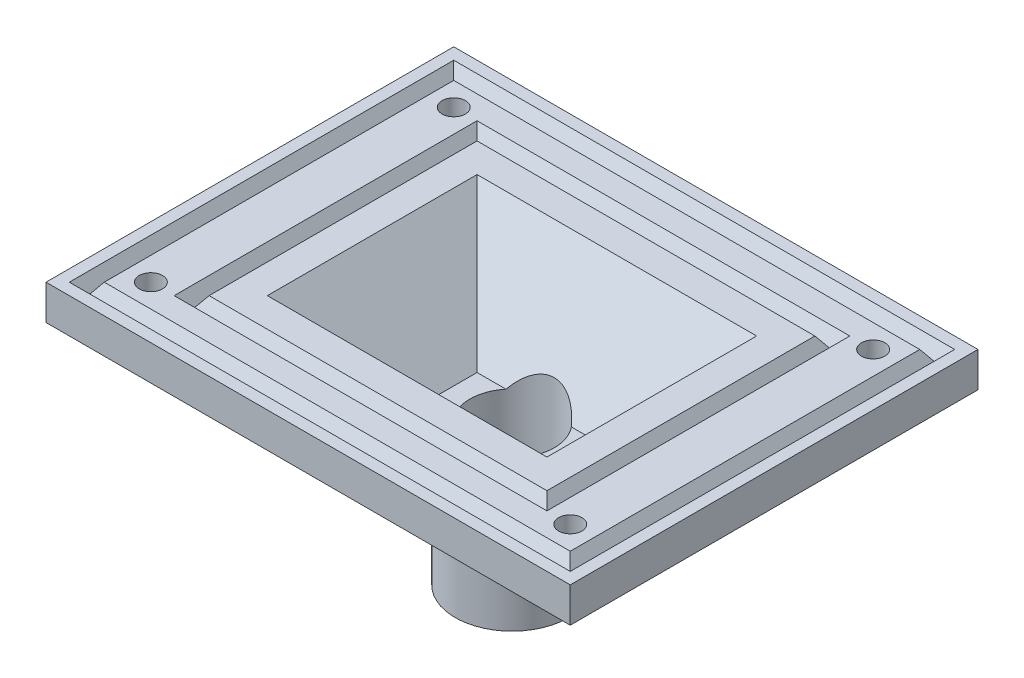
from build123d import *

# Parameters (mm, degrees)
SKETCH1_W               = 90
SKETCH1_H               = 70
BASE_PLATE_DEPTH        = 6
SKETCH4_W               = 86
SKETCH4_H               = 66
SKETCH4_W_2             = 80
SKETCH4_H_2             = 60
SEALANT_CUT_OUTER_DEPTH = 5
SEALANT_CUT_OUTER_TAPER = 35
SKETCH7_R               = 2
SCRE_CUT_DEPTH          = 5
SKETCH12_W              = 64
SKETCH12_H              = 52
SKETCH12_W_2            = 58
SKETCH12_H_2            = 46
SEALANT_CUT_INNER_DEPTH = 3
SEALANT_CUT_INNER_TAPER = 35
SKETCH14_W              = 65
SKETCH14_H              = 45
BASE_BLOCK_DEPTH        = 14
SKETCH13_W              = 48
SKETCH13_H              = 36
DRAIN_DEPTH             = 16
DRAIN_DRAFT             = -40
SKETCH15_R              = 9.75
HOSE_CONNECTOR_DEPTH    = 20
SKETCH16_R              = 7.25
DRAIN_HOLE_DEPTH        = 70.641941443
FILLET1_R               = 10
FILLET2_R               = 10
FILLET3_R               = 10
FILLET4_R               = 10
FILLET5_R               = 10


with BuildPart() as part:
    # Sketch1 → Base Plate (new body)
    with BuildSketch(Plane(origin=(0, 0, 0), x_dir=(1, 0, 0), z_dir=(0, 1, 0))):
        Rectangle(SKETCH1_W, SKETCH1_H)
    extrude(amount=BASE_PLATE_DEPTH)

    # Sketch4 → Sealant Cut - Outer (cut)
    with BuildSketch(Plane(origin=(0, 6, 0), x_dir=(1, 0, 0), z_dir=(0, 1, 0))):
        Rectangle(SKETCH4_W, SKETCH4_H)
        Rectangle(SKETCH4_W_2, SKETCH4_H_2, mode=Mode.SUBTRACT)
    extrude(amount=-SEALANT_CUT_OUTER_DEPTH, taper=SEALANT_CUT_OUTER_TAPER, mode=Mode.SUBTRACT)

    # Sketch7 → Scre Cut (cut)
    with BuildSketch(Plane(origin=(0, 6, 0), x_dir=(1, 0, 0), z_dir=(0, 1, 0))):
        with Locations(Location((-36, 26, 0), (0, 0, 270))):
            Circle(SKETCH7_R)
        with Locations(Location((-36, -26, 0), (0, 0, 90))):
            Circle(SKETCH7_R)
        with Locations(Location((36, -26, 0), (0, 0, 270))):
            Circle(SKETCH7_R)
        with Locations(Location((36, 26, 0), (0, 0, 90))):
            Circle(SKETCH7_R)
    extrude(amount=-SCRE_CUT_DEPTH, mode=Mode.SUBTRACT)

    # Sketch12 → Sealant Cut - Inner (cut)
    with BuildSketch(Plane(origin=(0, 6, 0), x_dir=(1, 0, 0), z_dir=(0, 1, 0))):
        Rectangle(SKETCH12_W, SKETCH12_H)
        Rectangle(SKETCH12_W_2, SKETCH12_H_2, mode=Mode.SUBTRACT)
    extrude(amount=-SEALANT_CUT_INNER_DEPTH, taper=SEALANT_CUT_INNER_TAPER, mode=Mode.SUBTRACT)

    # Sketch14 → Base Block (add)
    with BuildSketch(Plane.XZ):
        Rectangle(SKETCH14_W, SKETCH14_H)
    extrude(amount=BASE_BLOCK_DEPTH)


with BuildPart() as drain_tool:
    # Sketch13 → Drain (with draft: the straight prism first)
    with BuildSketch(Plane(origin=(0, 6, 0), x_dir=(1, 0, 0), z_dir=(0, 1, 0))):
        Rectangle(SKETCH13_W, SKETCH13_H)
    extrude(amount=-DRAIN_DEPTH)
    # Drain: the draft: its side faces are tilted about the plane it starts from
    drain_sides = [drain_tool.faces().sort_by_distance(p)[0] for p in [
        (-24, -2, 0),
        (0, -2, 18),
        (24, -2, 0),
        (0, -2, -18),
    ]]
    draft(drain_sides, Plane(origin=(0, 6, 0), x_dir=(1, 0, 0), z_dir=(0, 1, 0)), DRAIN_DRAFT)


with BuildPart() as part_1:
    add(part.part)

    # Drain: cut by drain_tool
    add(drain_tool.part, mode=Mode.SUBTRACT)

    # Sketch15 → Hose connector (add)
    with BuildSketch(Plane.XZ.offset(14)):
        with Locations(Location((0, 0, 0), (0, 0, 270))):
            Circle(SKETCH15_R)
    extrude(amount=HOSE_CONNECTOR_DEPTH)

    # Sketch16 → Drain Hole (cut, through all)
    with BuildSketch(Plane.XZ.offset(34)):
        with Locations(Location((0, 0, 0), (0, 0, 270))):
            Circle(SKETCH16_R)
    extrude(amount=-DRAIN_HOLE_DEPTH, mode=Mode.SUBTRACT)

    # Fillet1
    fillet1_edges = [part_1.edges().sort_by_distance(p)[0] for p in [
        (-32.5, -7, -22.5),
    ]]
    fillet(fillet1_edges, radius=FILLET1_R)

    # Fillet2
    fillet2_edges = [part_1.edges().sort_by_distance(p)[0] for p in [
        (32.5, -7, -22.5),
    ]]
    fillet(fillet2_edges, radius=FILLET2_R)

    # Fillet3
    fillet3_edges = [part_1.edges().sort_by_distance(p)[0] for p in [
        (32.5, -7, 22.5),
    ]]
    fillet(fillet3_edges, radius=FILLET3_R)

    # Fillet4
    fillet4_edges = [part_1.edges().sort_by_distance(p)[0] for p in [
        (-32.5, -7, 22.5),
    ]]
    fillet(fillet4_edges, radius=FILLET4_R)

    # Srew Heads cone 1 section (through the dimple's axis) → Srew Heads (revolve, cut)
    with BuildSketch(Plane(origin=(-36, 0, -26), x_dir=(0, 0, -1), z_dir=(1, 0, 0))):
        Polygon((0, 0), (2.75, 0), (0, 2.75), align=None)
    revolve(axis=Axis((-36, 0, -26), (0, 1, 0)), mode=Mode.SUBTRACT)

    # Srew Heads cone 2 section (through the dimple's axis) → Srew Heads cone 2 (revolve, cut)
    with BuildSketch(Plane(origin=(-36, 0, 26), x_dir=(0, 0, -1), z_dir=(1, 0, 0))):
        Polygon((0, 0), (2.75, 0), (0, 2.75), align=None)
    revolve(axis=Axis((-36, 0, 26), (0, 1, 0)), mode=Mode.SUBTRACT)

    # Srew Heads cone 3 section (through the dimple's axis) → Srew Heads cone 3 (revolve, cut)
    with BuildSketch(Plane(origin=(36, 0, 26), x_dir=(0, 0, -1), z_dir=(1, 0, 0))):
        Polygon((0, 0), (2.75, 0), (0, 2.75), align=None)
    revolve(axis=Axis((36, 0, 26), (0, 1, 0)), mode=Mode.SUBTRACT)

    # Srew Heads cone 4 section (through the dimple's axis) → Srew Heads cone 4 (revolve, cut)
    with BuildSketch(Plane(origin=(36, 0, -26), x_dir=(0, 0, -1), z_dir=(1, 0, 0))):
        Polygon((0, 0), (2.75, 0), (0, 2.75), align=None)
    revolve(axis=Axis((36, 0, -26), (0, 1, 0)), mode=Mode.SUBTRACT)

    # Fillet5
    fillet5_edges = [part_1.edges().sort_by_distance(p)[0] for p in [
        (0, -14, -22.5),
        (-29.571067812, -14, -19.571067812),
        (32.5, -14, 0),
        (29.571067812, -14, -19.571067812),
        (0, -14, 22.5),
        (29.571067812, -14, 19.571067812),
        (-32.5, -14, 0),
        (-29.571067812, -14, 19.571067812),
    ]]
    fillet(fillet5_edges, radius=FILLET5_R)


solid = part_1.part
